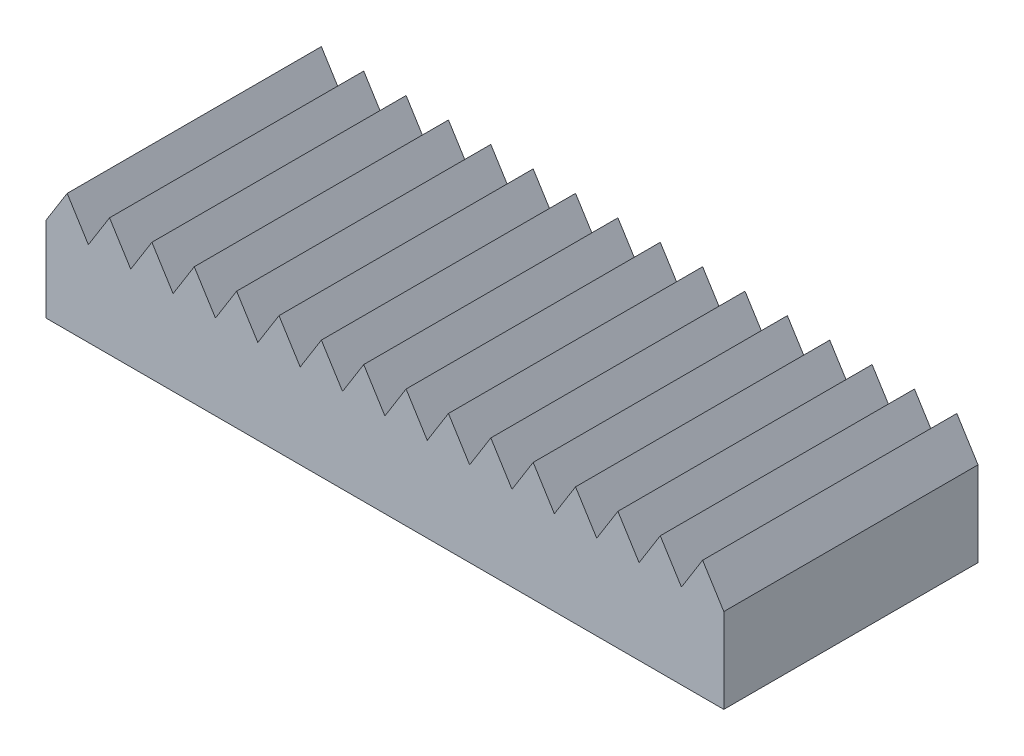
from build123d import *

# Parameters (mm, degrees)
BOSS_EXTRUDE1_DEPTH = 15


with BuildPart() as part:
    # Sketch1 → Boss-Extrude1 (new body)
    with BuildSketch(Plane.XY):
        Polygon((40, 0), (38.75, 2), (37.5, 0), (36.25, 2), (35, 0), (33.75, 2), (32.5, 0), (31.25, 2), (30, 0), (28.75, 2), (27.5, 0), (26.25, 2), (25, 0), (23.75, 2), (22.5, 0), (21.25, 2), (20, 0), (18.75, 2), (17.5, 0), (16.25, 2), (15, 0), (13.75, 2), (12.5, 0), (11.25, 2), (10, 0), (8.75, 2), (7.5, 0), (6.25, 2), (5, 0), (3.75, 2), (2.5, 0), (1.25, 2), (0, 0), (0, -5), (40, -5), align=None)
    extrude(amount=BOSS_EXTRUDE1_DEPTH)


solid = part.part
